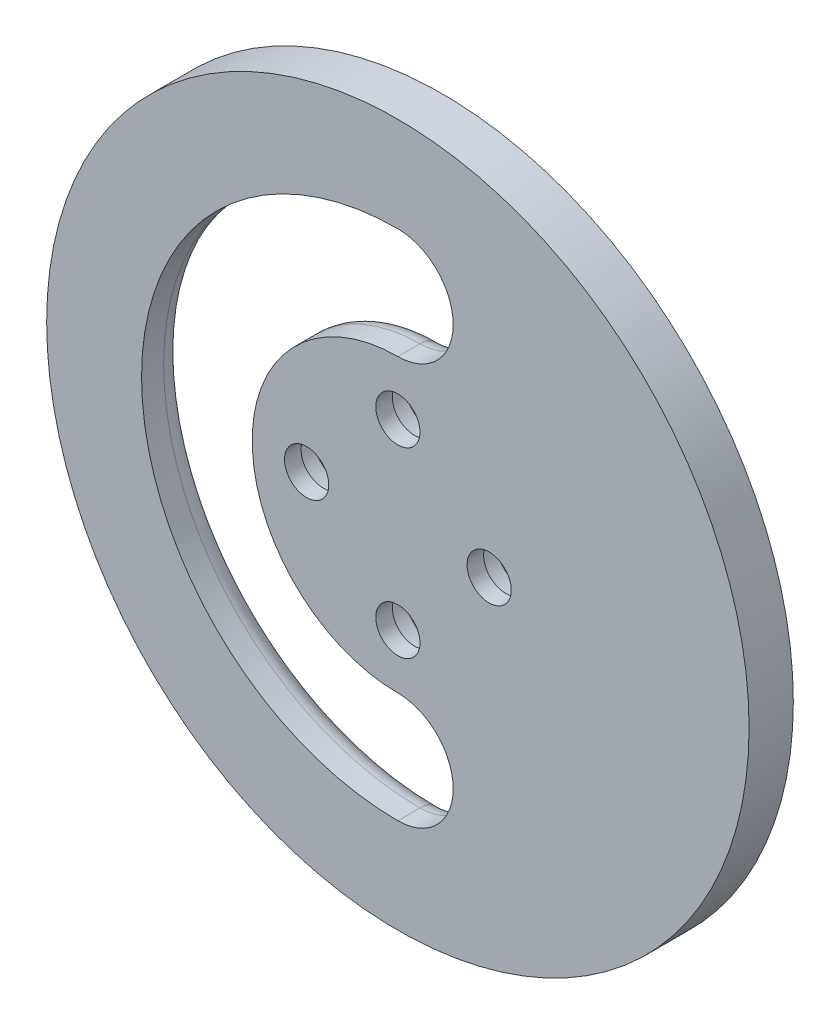
from build123d import *

# Parameters (mm, degrees)
SKETCH1_R                               = 31.75
ELBOW_PLATE_DEPTH                       = 4
SKETCH3_R                               = 1.33
SCREW_HOLES_DEPTH                       = 3
CABLE_SLOT_DEPTH                        = 4
FILLET1_R                               = 2
CBORE_FOR_M6_HEX_HEAD_BOLT1_D           = 4
CBORE_FOR_M6_HEX_HEAD_BOLT1_CBORE_D     = 7.5
CBORE_FOR_M6_HEX_HEAD_BOLT1_CBORE_DEPTH = 2.5


with BuildPart() as part:
    # Sketch1 → Elbow Plate (new body)
    with BuildSketch(Plane.XY):
        Circle(SKETCH1_R)
    extrude(amount=ELBOW_PLATE_DEPTH)

    # Sketch3 → Screw Holes (cut)
    with BuildSketch(Plane(origin=(0, 0, 0), x_dir=(-1, 0, 0), z_dir=(0, 0, -1))):
        with Locations((0, 26.75)):
            Circle(SKETCH3_R)
        with Locations((23.166179551, 13.375)):
            Circle(SKETCH3_R)
        with Locations((23.166179551, -13.375)):
            Circle(SKETCH3_R)
        with Locations((0, -26.75)):
            Circle(SKETCH3_R)
        with Locations((-23.166179551, -13.375)):
            Circle(SKETCH3_R)
        with Locations((-23.166179551, 13.375)):
            Circle(SKETCH3_R)
    extrude(amount=-SCREW_HOLES_DEPTH, mode=Mode.SUBTRACT)

    # Sketch4 → Cable Slot (cut)
    with BuildSketch(Plane.XY.offset(4)):
        with BuildLine():
            ThreePointArc((0, -23.172318516), (5.001159258, -18.171159258), (0, -13.17))
            ThreePointArc((0, -13.17), (-13.17, 0), (0, 13.17))
            ThreePointArc((0, 13.17), (5.001159258, 18.171159258), (0, 23.172318516))
            ThreePointArc((0, 23.172318516), (-23.172318516, 0), (0, -23.172318516))
        make_face()
    extrude(amount=-CABLE_SLOT_DEPTH, mode=Mode.SUBTRACT)

    # Fillet1
    fillet1_edges = [part.edges().sort_by_distance(p)[0] for p in [
        (-23.172318516, 0, 0),
        (5.001159258, 18.171159258, 0),
        (-13.17, 0, 0),
        (5.001159258, -18.171159258, 0),
    ]]
    fillet(fillet1_edges, radius=FILLET1_R)

    # CBORE for M6 Hex Head Bolt1 (through all)
    with Locations(Plane(origin=(0, 0, 0), x_dir=(-1, 0, 0), z_dir=(0, 0, -1))):
        with Locations((-8.25, 0), (0, -8.25), (8.25, 0), (0, 8.25)):
            CounterBoreHole(CBORE_FOR_M6_HEX_HEAD_BOLT1_D / 2, CBORE_FOR_M6_HEX_HEAD_BOLT1_CBORE_D / 2, CBORE_FOR_M6_HEX_HEAD_BOLT1_CBORE_DEPTH)


solid = part.part
